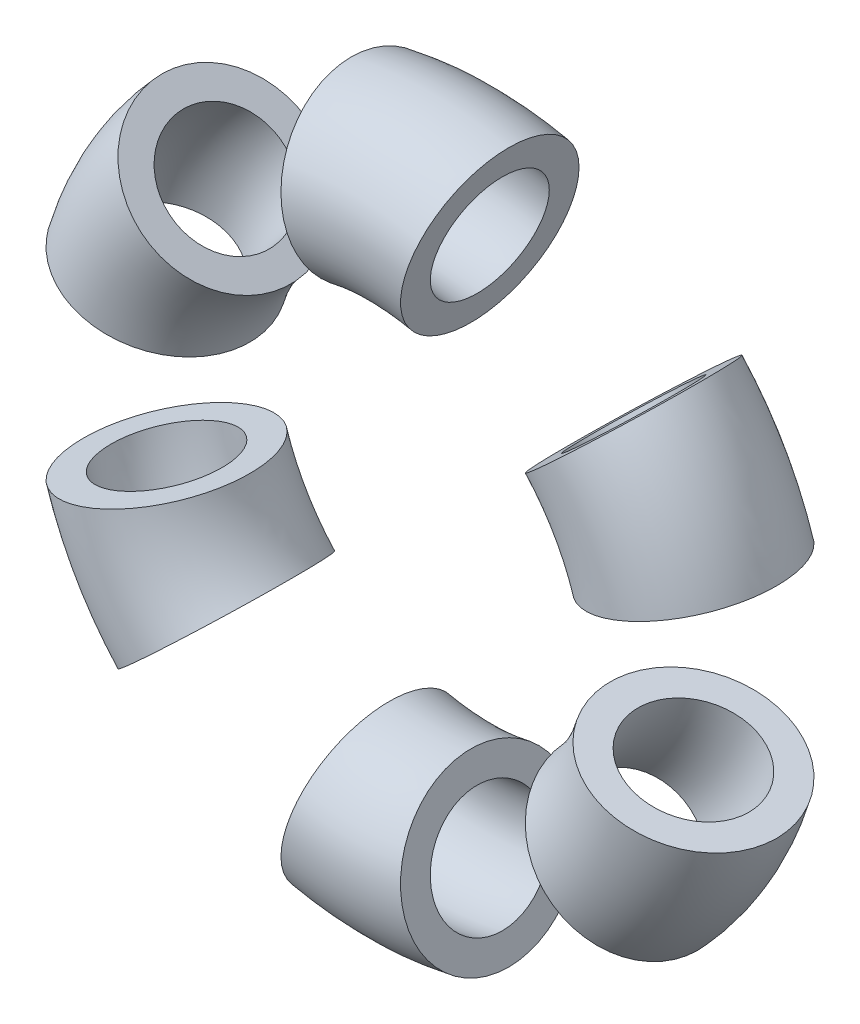
from build123d import *
from build123d.topology import SkipClean

# Parameters (mm, degrees)
SKIZZE2_R          = 3
SKIZZE2_R_2        = 2
ROTATION1_ANGLE    = 25
KREISMUSTER1_COUNT = 6


with BuildPart() as part:
    # Skizze2 → Rotation1 (revolve, symmetric)
    with SkipClean():  # the faces are left unmerged after this step: merging them gives an invalid solid
        with BuildSketch(Plane(origin=(0, 0, 0), x_dir=(0, 0, -1), z_dir=(1, 0, 0))) as rotation1_sk:
            with Locations((0, 9.5)):
                Circle(SKIZZE2_R)
            with Locations((0, 9.5)):
                Circle(SKIZZE2_R_2, mode=Mode.SUBTRACT)
        revolve(axis=Axis((0, 0, 37.728194726), (0, 0, -1)), revolution_arc=ROTATION1_ANGLE / 2)
        revolve(rotation1_sk.sketch, axis=Axis((0, 0, 37.728194726), (0, 0, 1)), revolution_arc=ROTATION1_ANGLE / 2)


with BuildPart() as kreismuster1_1:
    # Kreismuster1: pattern copy
    add(part.part.rotate(Axis((0, 0, 3.3), (0, 0, -1)), 1 * 360 / KREISMUSTER1_COUNT))


with BuildPart() as kreismuster1_2:
    # Kreismuster1: pattern copy
    add(part.part.rotate(Axis((0, 0, 3.3), (0, 0, -1)), 2 * 360 / KREISMUSTER1_COUNT))


with BuildPart() as kreismuster1_3:
    # Kreismuster1: pattern copy
    add(part.part.rotate(Axis((0, 0, 3.3), (0, 0, -1)), 3 * 360 / KREISMUSTER1_COUNT))


with BuildPart() as kreismuster1_4:
    # Kreismuster1: pattern copy
    add(part.part.rotate(Axis((0, 0, 3.3), (0, 0, -1)), 4 * 360 / KREISMUSTER1_COUNT))


with BuildPart() as kreismuster1_5:
    # Kreismuster1: pattern copy
    add(part.part.rotate(Axis((0, 0, 3.3), (0, 0, -1)), 5 * 360 / KREISMUSTER1_COUNT))


solid = Compound([part.part, kreismuster1_1.part, kreismuster1_2.part, kreismuster1_3.part, kreismuster1_4.part, kreismuster1_5.part])
